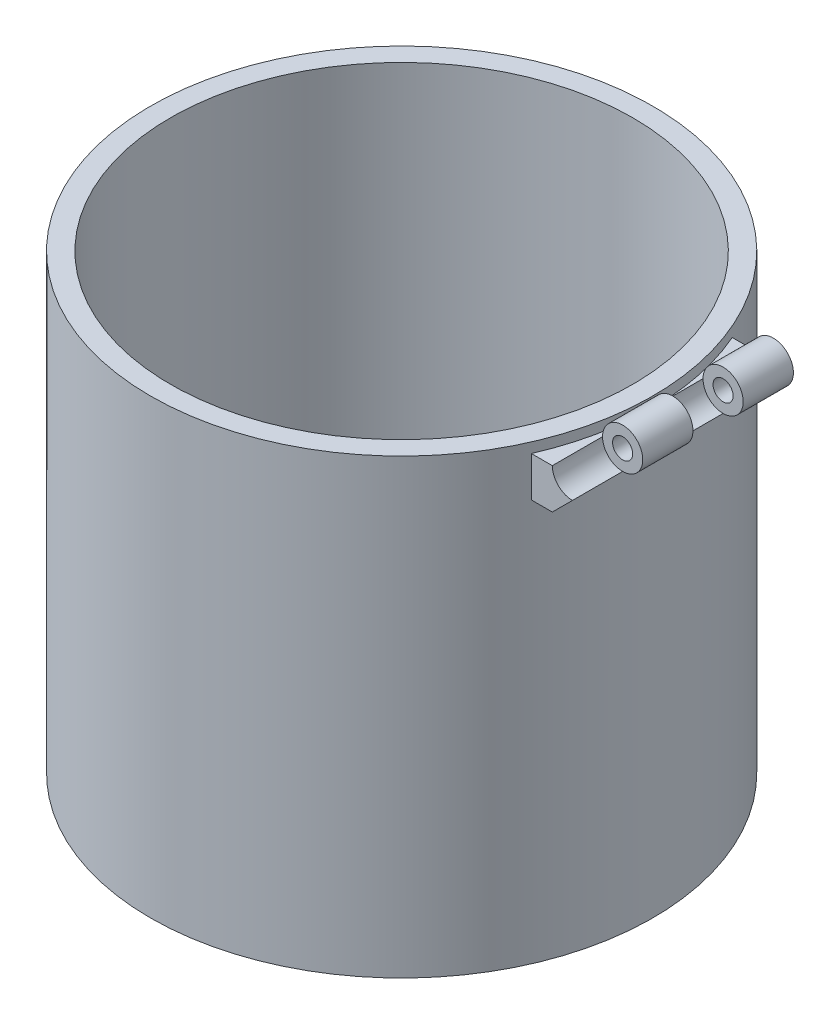
from build123d import *

# Parameters (mm, degrees)
SKETCH1_R                = 25
BOSS_EXTRUDE1_DEPTH      = 45
SHELL1_T                 = -2
SKETCH2_R                = 3.5
CUT_EXTRUDE1_DEPTH       = 2
BOSS_EXTRUDE4_DEPTH      = 10
BOSS_EXTRUDE4_DEPTH_BACK = 10
BOSS_EXTRUDE6_REACH      = 74.395
SKETCH8_W                = 20
SKETCH8_H                = 4
CUT_EXTRUDE4_DEPTH       = 65.668384857
CUT_EXTRUDE4_DEPTH_BACK  = 65.668384857
SKETCH9_R                = 1
CUT_EXTRUDE5_START       = -5
SKETCH10_R               = 2
CUT_EXTRUDE5_DEPTH       = 5
LPATTERN2_COUNT          = 2
LPATTERN2_PITCH          = 10


with BuildPart() as part:
    # Sketch1 → Boss-Extrude1 (new body)
    with BuildSketch(Plane(origin=(0, 0, 0), x_dir=(1, 0, 0), z_dir=(0, 1, 0))):
        with Locations(Location((0, 0, 0), (0, 0, 90))):
            Circle(SKETCH1_R)
    extrude(amount=BOSS_EXTRUDE1_DEPTH)

    # Shell1
    shell1_openings = [part.faces().sort_by_distance(p)[0] for p in [
        (0, 45, 0),
    ]]
    offset(amount=SHELL1_T, openings=shell1_openings, kind=Kind.INTERSECTION)

    # Sketch2 → Cut-Extrude1 (cut)
    with BuildSketch(Plane(origin=(0, 2, 0), x_dir=(1, 0, 0), z_dir=(0, 1, 0))):
        with Locations(Location((15, 0, 0), (0, 0, 270))):
            Circle(SKETCH2_R)
        with Locations(Location((7.5, -12.990381057, 0), (0, 0, 270))):
            Circle(SKETCH2_R)
        with Locations(Location((-7.5, -12.990381057, 0), (0, 0, 270))):
            Circle(SKETCH2_R)
        with Locations(Location((-15, 0, 0), (0, 0, 270))):
            Circle(SKETCH2_R)
        with Locations(Location((-7.5, 12.990381057, 0), (0, 0, 270))):
            Circle(SKETCH2_R)
        with Locations(Location((7.5, 12.990381057, 0), (0, 0, 270))):
            Circle(SKETCH2_R)
    extrude(amount=-CUT_EXTRUDE1_DEPTH, mode=Mode.SUBTRACT)

    # Sketch8 → Boss-Extrude6 (add, up to next)
    with BuildSketch(Plane.ZY.offset(-25), mode=Mode.PRIVATE) as boss_extrude6_sk1:
        with Locations((0, 42)):
            Rectangle(SKETCH8_W, SKETCH8_H)
    boss_extrude6_tool1 = extrude(boss_extrude6_sk1.sketch, amount=BOSS_EXTRUDE6_REACH, mode=Mode.PRIVATE) - part.part


with BuildPart() as body_2:
    # Sketch3 → Boss-Extrude4 (new, two sides: drawn at the far end of the back side and taken through both)
    with BuildSketch(Plane.XY.offset(-BOSS_EXTRUDE4_DEPTH_BACK)):
        with BuildLine():
            Line((25, 44), (25, 40))
            Line((25, 40), (27, 42))
            ThreePointArc((27, 42), (28.414213562, 45.414213562), (25, 44))
        make_face()
    extrude(amount=BOSS_EXTRUDE4_DEPTH + BOSS_EXTRUDE4_DEPTH_BACK)


with BuildPart() as part_1:
    add(part.part)

    add(body_2.part)  # Boss-Extrude6 merges body 2
    add(boss_extrude6_tool1.solids().sort_by_distance((25, 42, 0))[0])
    add(boss_extrude6_tool1.solids().sort_by_distance((25, 42, 0))[1])

    # Sketch9 → Cut-Extrude4 (cut, two sides: drawn at the far end of the back side and taken through both)
    with BuildSketch(Plane.XY.offset(10).offset(-CUT_EXTRUDE4_DEPTH_BACK)):
        with Locations((27, 44)):
            Circle(SKETCH9_R)
    extrude(amount=CUT_EXTRUDE4_DEPTH + CUT_EXTRUDE4_DEPTH_BACK, mode=Mode.SUBTRACT)

    # Sketch10 → Cut-Extrude5 (cut)
    with BuildSketch(Plane.XY.offset(10).offset(CUT_EXTRUDE5_START)):
        with Locations((27, 44)):
            Circle(SKETCH10_R)
    cut_extrude5 = extrude(amount=CUT_EXTRUDE5_DEPTH, mode=Mode.SUBTRACT)

    # LPattern2: Cut-Extrude5 ×2
    with Locations(*[(0, 0, -i * LPATTERN2_PITCH) for i in range(1, LPATTERN2_COUNT)]):
        add(cut_extrude5, mode=Mode.SUBTRACT)


solid = part_1.part
